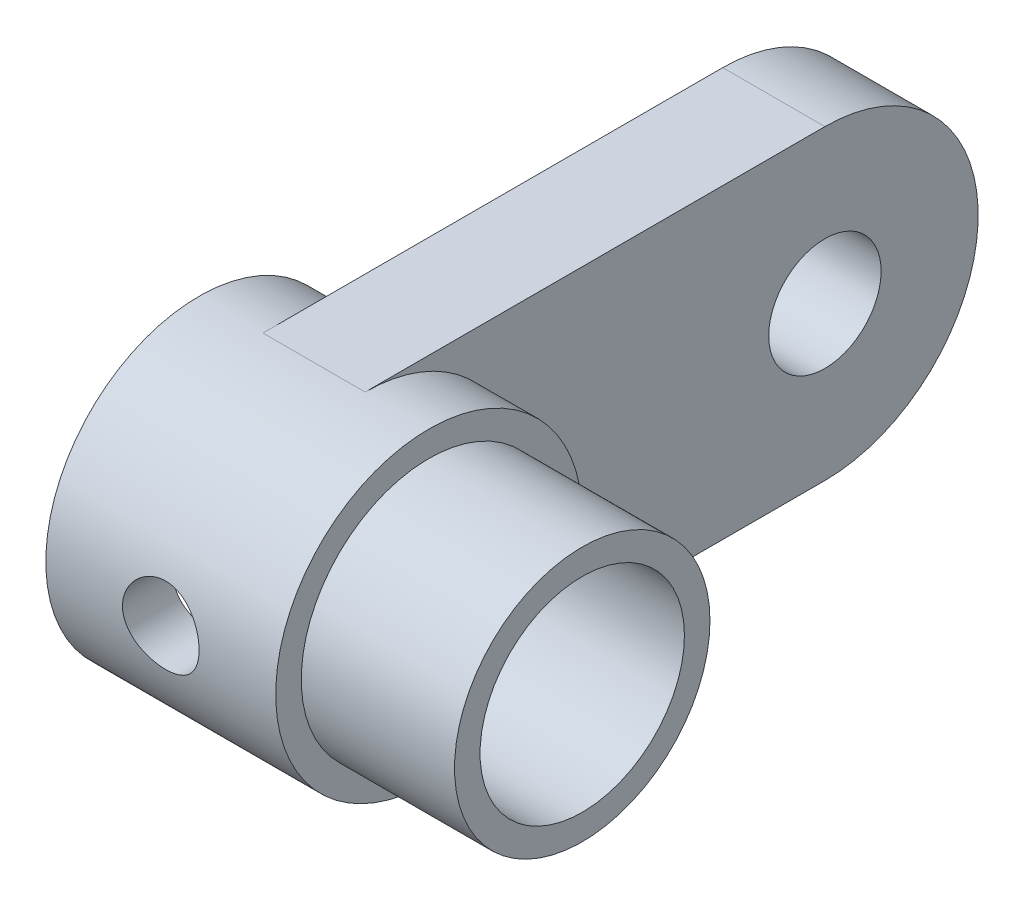
from build123d import *
from build123d.topology import SkipClean

# Parameters (mm, degrees)
EXTRUDE_2_DEPTH          = 4.5
EXTRUDE_2_DEPTH_BACK     = 4.5
CUT_EXTRUDE_1_DEPTH      = 7
CUT_EXTRUDE_1_DEPTH_BACK = 6
CUT_EXTRUDE_2_DEPTH      = 6
CUT_EXTRUDE_2_DEPTH_BACK = 6
SKETCH_10_R              = 2.2
CUT_EXTRUDE_3_DEPTH      = 2.5
SKETCH_13_R              = 3.5
SKETCH_13_R_2            = 2.2
EXTRUDE_3_DEPTH          = 2
CHAMFER_3_SIZE           = 0.5
SKETCH_18_R              = 5
EXTRUDE_5_DEPTH          = 6
SKETCH_19_R              = 4
CUT_EXTRUDE_5_DEPTH      = 16
CHAMFER_4_SIZE           = 1
SKETCH_22_R              = 1.5
CUT_EXTRUDE_6_DEPTH      = 10


with BuildPart() as part:
    # 草图5 → 凸台-拉伸2 (new, two sides: drawn at the far end of the back side and taken through both)
    with BuildSketch(Plane(origin=(0, 0, 0), x_dir=(0, 0, -1), z_dir=(1, 0, 0)).offset(-EXTRUDE_2_DEPTH_BACK)):
        with BuildLine():
            Line((0, -6), (18, -6))
            ThreePointArc((18, -6), (24, 0), (18, 6))
            Line((18, 6), (0, 6))
            ThreePointArc((0, 6), (-6, 0), (0, -6))
        make_face()
    extrude(amount=EXTRUDE_2_DEPTH + EXTRUDE_2_DEPTH_BACK)

    # 草图7 → 切除-拉伸1 (cut, two sides: drawn at the far end of the back side and taken through both)
    with BuildSketch(Plane(origin=(0, 0, 0), x_dir=(0, 0, -1), z_dir=(1, 0, 0)).offset(-CUT_EXTRUDE_1_DEPTH_BACK)):
        with BuildLine():
            ThreePointArc((3.464101615, 2), (-4, 0), (3.464101615, -2))
            ThreePointArc((3.464101615, -2), (4, 0), (3.464101615, 2))
        make_face()
    extrude(amount=CUT_EXTRUDE_1_DEPTH + CUT_EXTRUDE_1_DEPTH_BACK, mode=Mode.SUBTRACT)

    # 草图10 → 切除-拉伸2 (cut, two sides: drawn at the far end of the back side and taken through both)
    with BuildSketch(Plane(origin=(0, 0, 0), x_dir=(0, 0, -1), z_dir=(1, 0, 0)).offset(-CUT_EXTRUDE_2_DEPTH_BACK)):
        with Locations((18, 0)):
            Circle(SKETCH_10_R)
    extrude(amount=CUT_EXTRUDE_2_DEPTH + CUT_EXTRUDE_2_DEPTH_BACK, mode=Mode.SUBTRACT)

    # 草图11 → 切除-拉伸3 (cut)
    with BuildSketch(Plane.ZY.offset(4.5)):
        with BuildLine():
            Line((-18, 6), (0, 6))
            ThreePointArc((0, 6), (-6, 0), (0, -6))
            Line((0, -6), (-18, -6))
            ThreePointArc((-18, -6), (-24, 0), (-18, 6))
        make_face()
    cut_extrude_3 = extrude(amount=-CUT_EXTRUDE_3_DEPTH, mode=Mode.SUBTRACT)

    # 镜向2: 切除-拉伸3 across plane
    add(cut_extrude_3.mirror(Plane(origin=(0, 0, 0), x_dir=(0, 0, 1), z_dir=(1, 0, 0))), mode=Mode.SUBTRACT)

    # 草图13 → 凸台-拉伸3 (add)
    with SkipClean():  # the faces are left unmerged after this step: merging them gives an invalid solid
        with BuildSketch(Plane.ZY.offset(2)):
            with Locations((-18, 0)):
                Circle(SKETCH_13_R)
            with Locations((-18, 0)):
                Circle(SKETCH_13_R_2, mode=Mode.SUBTRACT)
        extrude(amount=EXTRUDE_3_DEPTH)

    # 倒角3
    chamfer_3_edges = [part.edges().sort_by_distance(p)[0] for p in [
        (-4, 0, -21.5),
    ]]
    chamfer(chamfer_3_edges, length=CHAMFER_3_SIZE)

    # 草图18 → 凸台-拉伸5 (add)
    with SkipClean():  # the faces are left unmerged after this step: merging them gives an invalid solid
        with BuildSketch(Plane(origin=(4.5, 0, 0), x_dir=(0, 0, -1), z_dir=(1, 0, 0))):
            Circle(SKETCH_18_R)
        extrude(amount=EXTRUDE_5_DEPTH)

    # 草图19 → 切除-拉伸5 (cut)
    with SkipClean():  # the faces are left unmerged after this step: merging them gives an invalid solid
        with BuildSketch(Plane(origin=(10.5, 0, 0), x_dir=(0, 0, -1), z_dir=(1, 0, 0))):
            Circle(SKETCH_19_R)
        extrude(amount=-CUT_EXTRUDE_5_DEPTH, mode=Mode.SUBTRACT)

    # 倒角4
    chamfer_4_edges = [part.edges().sort_by_distance(p)[0] for p in [
        (-4.5, -1.03527618, -3.863703305),
    ]]
    chamfer(chamfer_4_edges, length=CHAMFER_4_SIZE)

    # 草图22 → 切除-拉伸6 (cut)
    with SkipClean():  # the faces are left unmerged after this step: merging them gives an invalid solid
        with BuildSketch(Plane.XY.offset(6)):
            Circle(SKETCH_22_R)
        extrude(amount=-CUT_EXTRUDE_6_DEPTH, mode=Mode.SUBTRACT)


solid = part.part
